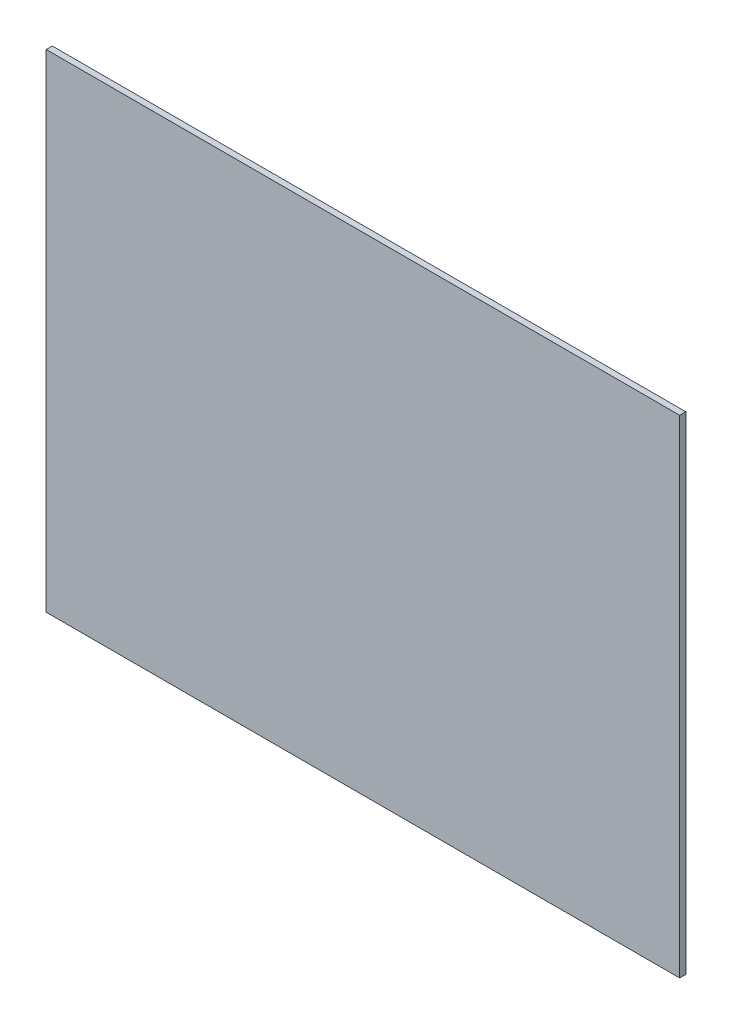
from build123d import *

# Parameters (mm, degrees)
SKETCH1_W           = 330.2
SKETCH1_H           = 254
BOSS_EXTRUDE1_DEPTH = 3.175


with BuildPart() as part:
    # Sketch1 → Boss-Extrude1 (new body)
    with BuildSketch(Plane.XY):
        with Locations((133.029996245, -102.723086592)):
            Rectangle(SKETCH1_W, SKETCH1_H)
    extrude(amount=BOSS_EXTRUDE1_DEPTH)


solid = part.part
